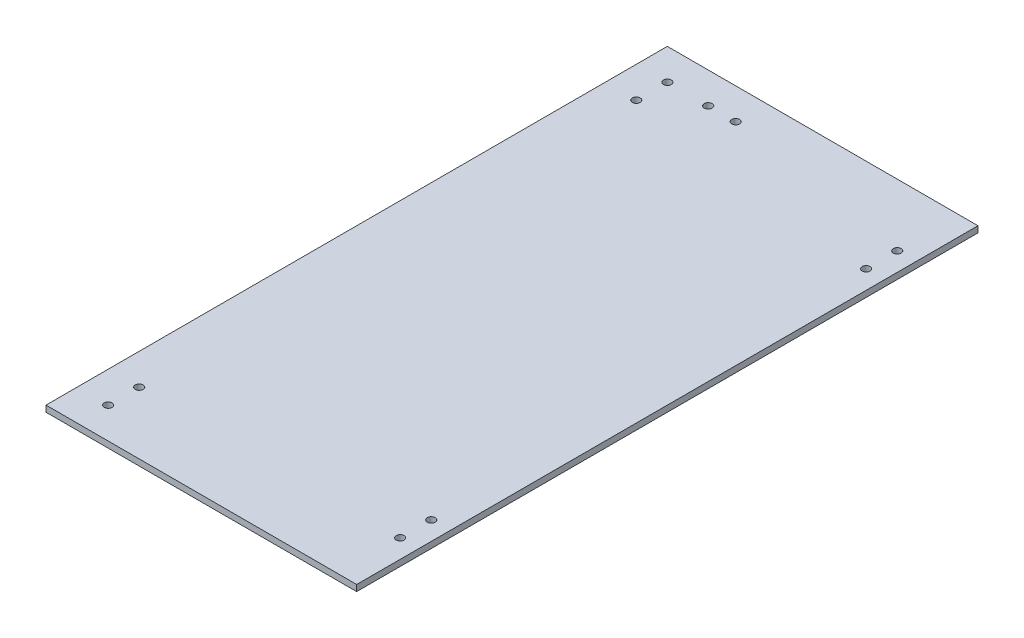
from build123d import *

# Parameters (mm, degrees)
SKETCH1_W           = 250
SKETCH1_H           = 500
BOSS_EXTRUDE1_DEPTH = 5
SKETCH2_R           = 3.175
CUT_EXTRUDE1_DEPTH  = 10
SKETCH4_R           = 3.175
CUT_EXTRUDE3_DEPTH  = 10
SKETCH5_R           = 3.175
CUT_EXTRUDE4_DEPTH  = 10


with BuildPart() as part:
    # Sketch1 → Boss-Extrude1 (new body)
    with BuildSketch(Plane(origin=(0, 0, 0), x_dir=(1, 0, 0), z_dir=(0, 1, 0))):
        with Locations((125, 250)):
            Rectangle(SKETCH1_W, SKETCH1_H)
    extrude(amount=BOSS_EXTRUDE1_DEPTH)

    # Sketch2 → Cut-Extrude1 (cut)
    with BuildSketch(Plane(origin=(0, 5, 0), x_dir=(1, 0, 0), z_dir=(0, 1, 0))):
        with Locations(Location((25, 25, 0), (0, 0, 270))):
            Circle(SKETCH2_R)
        with Locations(Location((25, 50, 0), (0, 0, 270))):
            Circle(SKETCH2_R)
        with Locations(Location((25, 475, 0), (0, 0, 270))):
            Circle(SKETCH2_R)
        with Locations(Location((25, 450, 0), (0, 0, 270))):
            Circle(SKETCH2_R)
    extrude(amount=-CUT_EXTRUDE1_DEPTH, mode=Mode.SUBTRACT)

    # Sketch4 → Cut-Extrude3 (cut)
    with BuildSketch(Plane.XZ):
        with Locations(Location((235, -425, 0), (0, 0, 270))):
            Circle(SKETCH4_R)
        with Locations(Location((235, -50, 0), (0, 0, 270))):
            Circle(SKETCH4_R)
        with Locations(Location((235, -75, 0), (0, 0, 270))):
            Circle(SKETCH4_R)
        with Locations(Location((235, -450, 0), (0, 0, 270))):
            Circle(SKETCH4_R)
    extrude(amount=-CUT_EXTRUDE3_DEPTH, mode=Mode.SUBTRACT)

    # Sketch5 → Cut-Extrude4 (cut)
    with BuildSketch(Plane(origin=(0, 5, 0), x_dir=(1, 0, 0), z_dir=(0, 1, 0))):
        with Locations(Location((80, 475, 0), (0, 0, 270))):
            Circle(SKETCH5_R)
        with Locations(Location((57.902, 475, 0), (0, 0, 270))):
            Circle(SKETCH5_R)
    extrude(amount=-CUT_EXTRUDE4_DEPTH, mode=Mode.SUBTRACT)


solid = part.part
